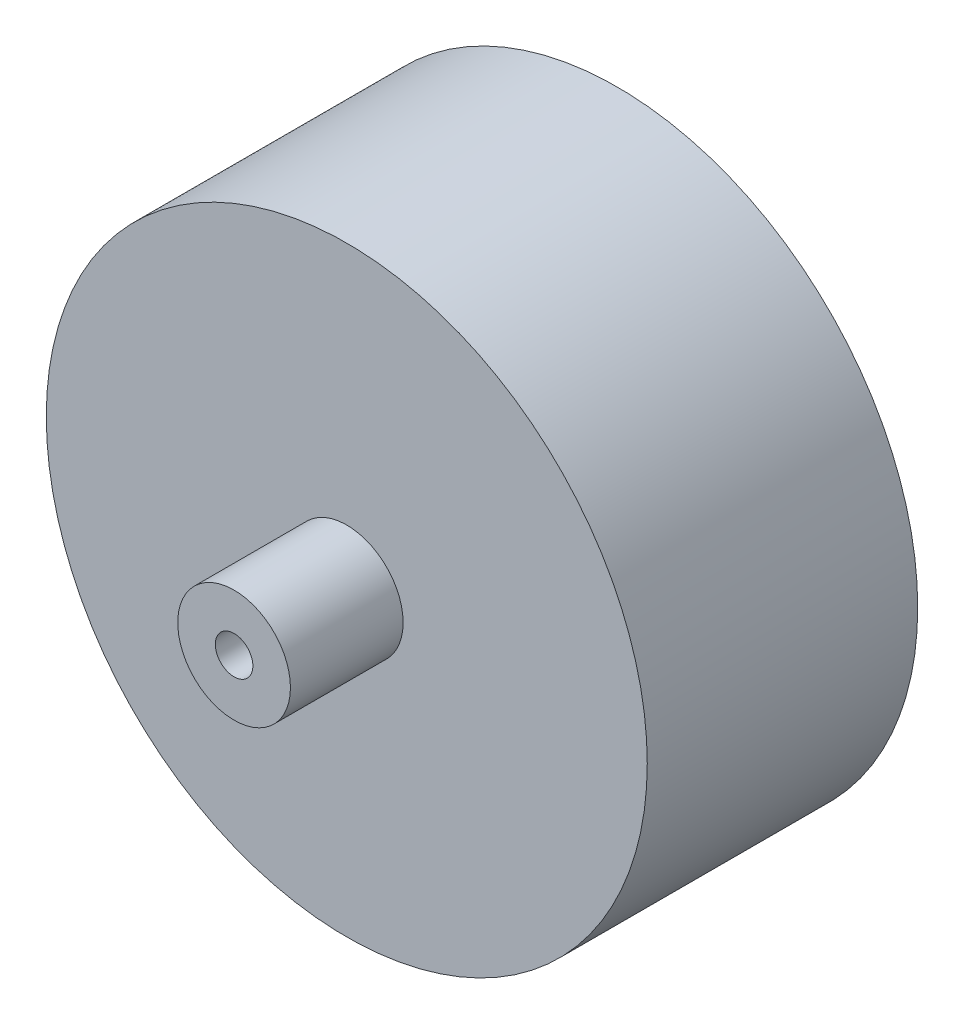
from build123d import *

# Parameters (mm, degrees)
SKETCH_1_R          = 40
EXTRUDE_1_DEPTH     = 36
SKETCH_2_R          = 7.5
EXTRUDE_2_DEPTH     = 15
SKETCH_3_R          = 2.5
CUT_EXTRUDE_1_DEPTH = 15


with BuildPart() as part:
    # ｽｹｯﾁ1 → ﾎﾞｽ - 押し出し1 (new body)
    with BuildSketch(Plane.XY):
        Circle(SKETCH_1_R)
    extrude(amount=EXTRUDE_1_DEPTH)

    # ｽｹｯﾁ2 → ﾎﾞｽ - 押し出し2 (add)
    with BuildSketch(Plane.XY.offset(36)):
        Circle(SKETCH_2_R)
    extrude(amount=EXTRUDE_2_DEPTH)

    # ｽｹｯﾁ3 → ｶｯﾄ - 押し出し1 (cut)
    with BuildSketch(Plane.XY.offset(51)):
        Circle(SKETCH_3_R)
    extrude(amount=-CUT_EXTRUDE_1_DEPTH, mode=Mode.SUBTRACT)


solid = part.part
